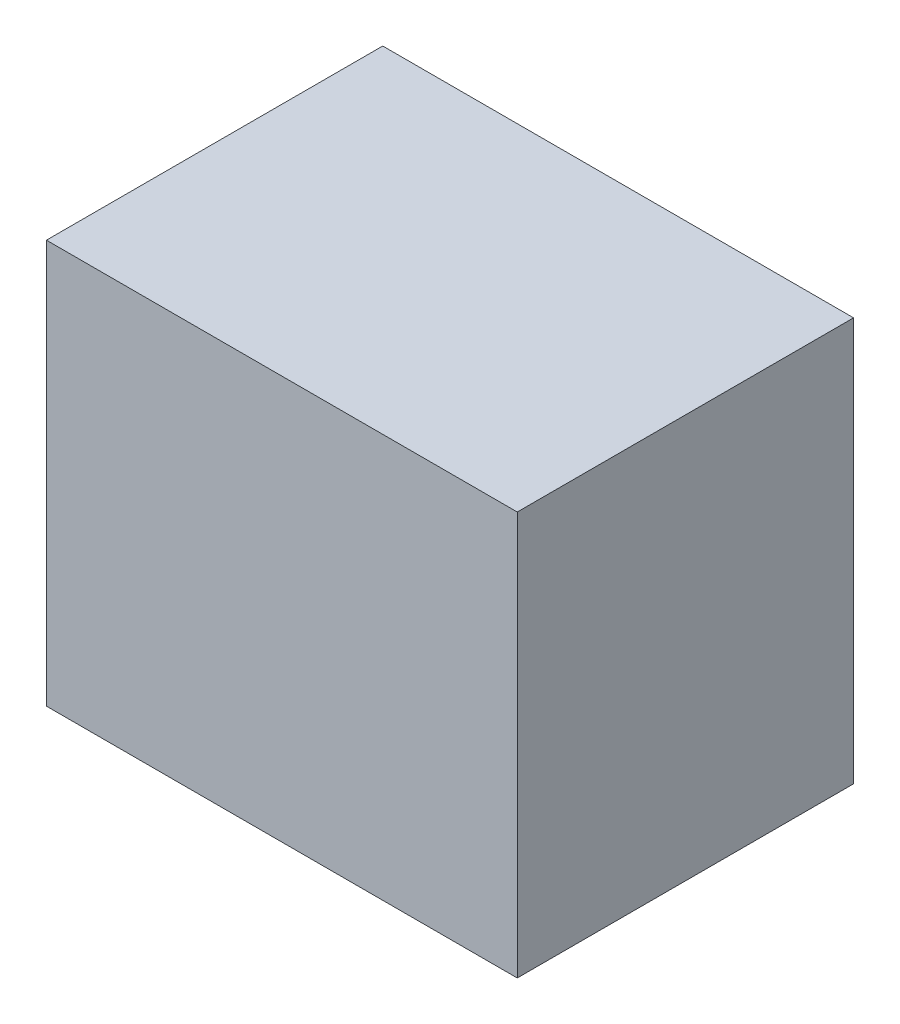
from build123d import *

# Parameters (mm, degrees)
SKETCH1_W           = 70
SKETCH1_H           = 60
BOSS_EXTRUDE1_DEPTH = 50


with BuildPart() as part:
    # Sketch1 → Boss-Extrude1 (new body)
    with BuildSketch(Plane.XY):
        Rectangle(SKETCH1_W, SKETCH1_H)
    extrude(amount=BOSS_EXTRUDE1_DEPTH)


solid = part.part
